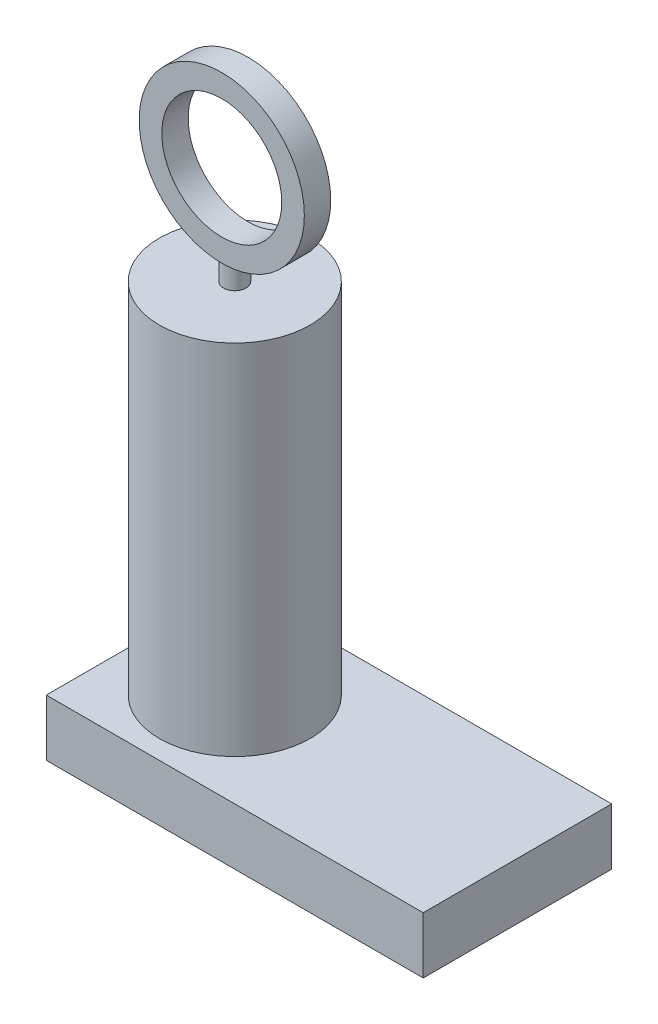
from build123d import *

# Parameters (mm, degrees)
SKETCH1_R           = 40
BOSS_EXTRUDE1_DEPTH = 190
SKETCH3_W           = 200
SKETCH3_H           = 100
BOSS_EXTRUDE3_DEPTH = 30
SKETCH4_R           = 6
BOSS_EXTRUDE4_DEPTH = 20
SKETCH5_W           = 14
SKETCH5_H           = 12


with BuildPart() as part:
    # Sketch1 → Boss-Extrude1 (new body)
    with BuildSketch(Plane(origin=(0, 0, 0), x_dir=(1, 0, 0), z_dir=(0, 1, 0))):
        with Locations(Location((0, 0, 0), (0, 0, 270))):
            Circle(SKETCH1_R)
    extrude(amount=BOSS_EXTRUDE1_DEPTH)

    # Sketch3 → Boss-Extrude3 (add)
    with BuildSketch(Plane.XZ):
        with Locations((50, 0)):
            Rectangle(SKETCH3_W, SKETCH3_H)
    extrude(amount=BOSS_EXTRUDE3_DEPTH)

    # Sketch4 → Boss-Extrude4 (add)
    with BuildSketch(Plane(origin=(0, 190, 0), x_dir=(1, 0, 0), z_dir=(0, 1, 0))):
        with Locations(Location((0, 0, 0), (0, 0, 270))):
            Circle(SKETCH4_R)
    extrude(amount=BOSS_EXTRUDE4_DEPTH)


with BuildPart() as body_2:
    # Sketch5 → Revolve1 (revolve)
    with BuildSketch(Plane(origin=(0, 0, 0), x_dir=(0, 0, -1), z_dir=(1, 0, 0)), mode=Mode.PRIVATE) as revolve1_sk:
        with Locations((0.099371949, 207.877080342)):
            Rectangle(SKETCH5_W, SKETCH5_H)
    revolve(revolve1_sk.sketch.rotate(Axis((0, 245.698971078, 6), (0, 0, -1)), 270), axis=Axis((0, 245.698971078, 6), (0, 0, -1)))


solid = Compound([part.part, body_2.part])
